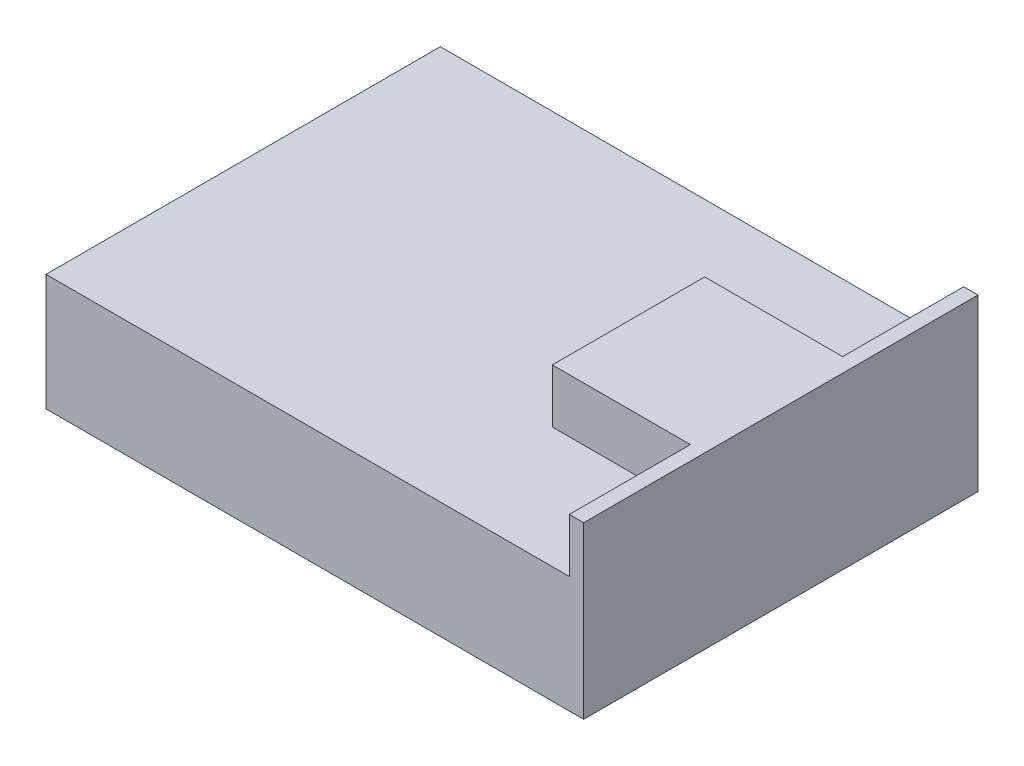
from build123d import *

# Parameters (mm, degrees)
SKETCH_1_W          = 60
SKETCH_1_H          = 44
EXTRUDE_1_DEPTH     = 19
SKETCH_2_W          = 58.4
SKETCH_2_H          = 6
CUT_EXTRUDE_1_DEPTH = 57.542019773
SKETCH_3_W          = 15.4
SKETCH_3_H          = 17
EXTRUDE_2_DEPTH     = 6


with BuildPart() as part:
    # 草图1 → 凸台-拉伸1 (new body)
    with BuildSketch(Plane(origin=(0, 19, 0), x_dir=(1, 0, 0), z_dir=(0, 1, 0))):
        Rectangle(SKETCH_1_W, SKETCH_1_H)
    extrude(amount=-EXTRUDE_1_DEPTH)

    # 草图2 → 切除-拉伸1 (cut, through all)
    with BuildSketch(Plane(origin=(0, 0, -22), x_dir=(-1, 0, 0), z_dir=(0, 0, -1))):
        with Locations((0.8, 16)):
            Rectangle(SKETCH_2_W, SKETCH_2_H)
    extrude(amount=-CUT_EXTRUDE_1_DEPTH, mode=Mode.SUBTRACT)

    # 草图3 → 凸台-拉伸2 (add)
    with BuildSketch(Plane(origin=(0, 13, 0), x_dir=(-1, 0, 0), z_dir=(0, 1, 0))):
        with Locations((-20.7, 0)):
            Rectangle(SKETCH_3_W, SKETCH_3_H)
    extrude(amount=EXTRUDE_2_DEPTH)


solid = part.part
